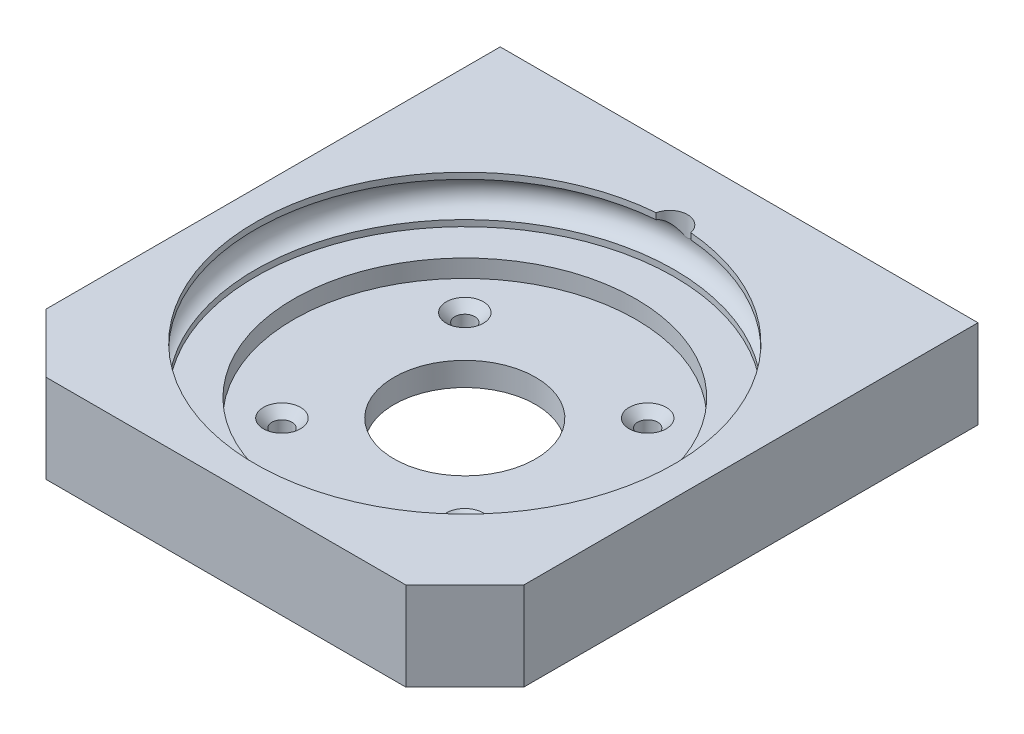
from build123d import *

# Parameters (mm, degrees)
SKETCH3_R                                           = 1.25
CUT_EXTRUDE1_DEPTH                                  = 59.322379924
SKETCH5_R                                           = 3.05
SKETCH6_R                                           = 3
CUT_EXTRUDE2_DEPTH                                  = 10
BOSS_EXTRUDE1_START                                 = -15
BOSS_EXTRUDE1_DEPTH                                 = 15
CHAMFER1_SIZE                                       = 10
CSK_FOR_M3_COUNTERSUNK_FLAT_HEAD_SCREW1_D           = 3.4
CSK_FOR_M3_COUNTERSUNK_FLAT_HEAD_SCREW1_CSINK_D     = 6.3
CSK_FOR_M3_COUNTERSUNK_FLAT_HEAD_SCREW1_CSINK_ANGLE = 90
SKETCH15_W                                          = 81
SKETCH15_H                                          = 15
BOSS_EXTRUDE2_DEPTH                                 = 6
SKETCH16_R                                          = 2.95
CUT_EXTRUDE3_DEPTH                                  = 6.8
M4_CLEARANCE_HOLE1_D                                = 4.8
M4_CLEARANCE_HOLE1_DEPTH                            = 14
M4_CLEARANCE_HOLE1_TIP                              = 1.442065486


with BuildPart() as part:
    # Sketch2 → Revolve1 (revolve)
    with BuildSketch(Plane.XY, mode=Mode.PRIVATE) as revolve1_sk:
        Polygon((-29, 3), (-29, 0), (-12, 0), (-12, -4), (-40.5, -4), (-40.5, 11), (-35.5, 11), (-35.5, 3), align=None)
    revolve(revolve1_sk.sketch.rotate(Axis((0, 0, 0), (0, 1, 0)), 270), axis=Axis((0, 0, 0), (0, 1, 0)))

    # Sketch3 → Cut-Extrude1 (cut, through all)
    with BuildSketch(Plane(origin=(0, 0, 0), x_dir=(1, 0, 0), z_dir=(0, 1, 0))):
        with Locations(Location((-15.5, 15.5, 0), (0, 0, 270))):
            Circle(SKETCH3_R)
        with Locations(Location((15.5, 15.5, 0), (0, 0, 270))):
            Circle(SKETCH3_R)
        with Locations(Location((15.5, -15.5, 0), (0, 0, 270))):
            Circle(SKETCH3_R)
        with Locations(Location((-15.5, -15.5, 0), (0, 0, 270))):
            Circle(SKETCH3_R)
    extrude(amount=-CUT_EXTRUDE1_DEPTH, mode=Mode.SUBTRACT)

    # Sketch5 → Cut-Revolve1 (revolve, cut)
    with BuildSketch(Plane.XY, mode=Mode.PRIVATE) as cut_revolve1_sk:
        with Locations((34.75, 7)):
            Circle(SKETCH5_R)
    revolve(cut_revolve1_sk.sketch.rotate(Axis((0, 0, 0), (0, -1, 0)), 270), axis=Axis((0, 0, 0), (0, -1, 0)), mode=Mode.SUBTRACT)

    # Sketch6 → Cut-Extrude2 (cut)
    with BuildSketch(Plane(origin=(0, 7, 0), x_dir=(1, 0, 0), z_dir=(0, 1, 0))):
        with Locations((0, 34.75)):
            Circle(SKETCH6_R)
    extrude(amount=CUT_EXTRUDE2_DEPTH, mode=Mode.SUBTRACT)

    # Sketch8 → Boss-Extrude1 (add)
    with BuildSketch(Plane.XZ.offset(4).offset(BOSS_EXTRUDE1_START)):
        with BuildLine():
            Line((-40.5, 1.41e-07), (-40.5, -40.5))
            Line((-40.5, -40.5), (-8.3e-08, -40.5))
            ThreePointArc((-8.3e-08, -40.5), (-28.637824717, -28.637824559), (-40.5, 1.41e-07))
        make_face()
        with BuildLine():
            ThreePointArc((40.5, 0), (28.637824609, -28.637824667), (-8.3e-08, -40.5))
            Line((-8.3e-08, -40.5), (40.5, -40.5))
            Line((40.5, -40.5), (40.5, 0))
        make_face()
        with BuildLine():
            Line((-40.5, 40.5), (-40.5, 1.41e-07))
            ThreePointArc((-40.5, 1.41e-07), (-28.637824588, 28.637824688), (0, 40.5))
            Line((0, 40.5), (-40.5, 40.5))
        make_face()
        with BuildLine():
            ThreePointArc((0, 40.5), (28.637824638, 28.637824638), (40.5, 0))
            Line((40.5, 0), (40.5, 40.5))
            Line((40.5, 40.5), (0, 40.5))
        make_face()
    extrude(amount=BOSS_EXTRUDE1_DEPTH)

    # Chamfer1
    chamfer1_edges = [part.edges().sort_by_distance(p)[0] for p in [
        (-40.5, 3.5, 40.5),
        (40.5, 3.5, 40.5),
    ]]
    chamfer(chamfer1_edges, length=CHAMFER1_SIZE)

    # CSK for M3 Countersunk Flat Head Screw1 (through all)
    with Locations(Plane(origin=(0, 0, 0), x_dir=(1, 0, 0), z_dir=(0, 1, 0))):
        with Locations((-15.5, 15.5), (15.5, 15.5), (15.5, -15.5), (-15.5, -15.5)):
            CounterSinkHole(CSK_FOR_M3_COUNTERSUNK_FLAT_HEAD_SCREW1_D / 2, CSK_FOR_M3_COUNTERSUNK_FLAT_HEAD_SCREW1_CSINK_D / 2, counter_sink_angle=CSK_FOR_M3_COUNTERSUNK_FLAT_HEAD_SCREW1_CSINK_ANGLE)

    # Sketch15 → Boss-Extrude2 (add)
    with BuildSketch(Plane(origin=(0, 0, -40.5), x_dir=(-1, 0, 0), z_dir=(0, 0, -1))):
        with Locations((0, 3.5)):
            Rectangle(SKETCH15_W, SKETCH15_H)
    extrude(amount=BOSS_EXTRUDE2_DEPTH)

    # Sketch16 → Cut-Extrude3 (cut)
    with BuildSketch(Plane(origin=(0, 0, -46.5), x_dir=(-1, 0, 0), z_dir=(0, 0, -1))):
        with Locations((-27.5, 3.5)):
            Circle(SKETCH16_R)
        with Locations(Location((27.5, 3.5, 0), (0, 0, 180))):
            Circle(SKETCH16_R)
    extrude(amount=-CUT_EXTRUDE3_DEPTH, mode=Mode.SUBTRACT)

    # M4 Clearance Hole1
    with Locations(Plane(origin=(0, 0, -46.5), x_dir=(-1, 0, 0), z_dir=(0, 0, -1))):
        with Locations((-27.5, 3.5), (27.5, 3.5)):
            Hole(M4_CLEARANCE_HOLE1_D / 2, depth=M4_CLEARANCE_HOLE1_DEPTH)
            with Locations((0, 0, -(M4_CLEARANCE_HOLE1_DEPTH + M4_CLEARANCE_HOLE1_TIP / 2))):  # 118° drill point
                Cone(0, M4_CLEARANCE_HOLE1_D / 2, M4_CLEARANCE_HOLE1_TIP, mode=Mode.SUBTRACT)


solid = part.part
